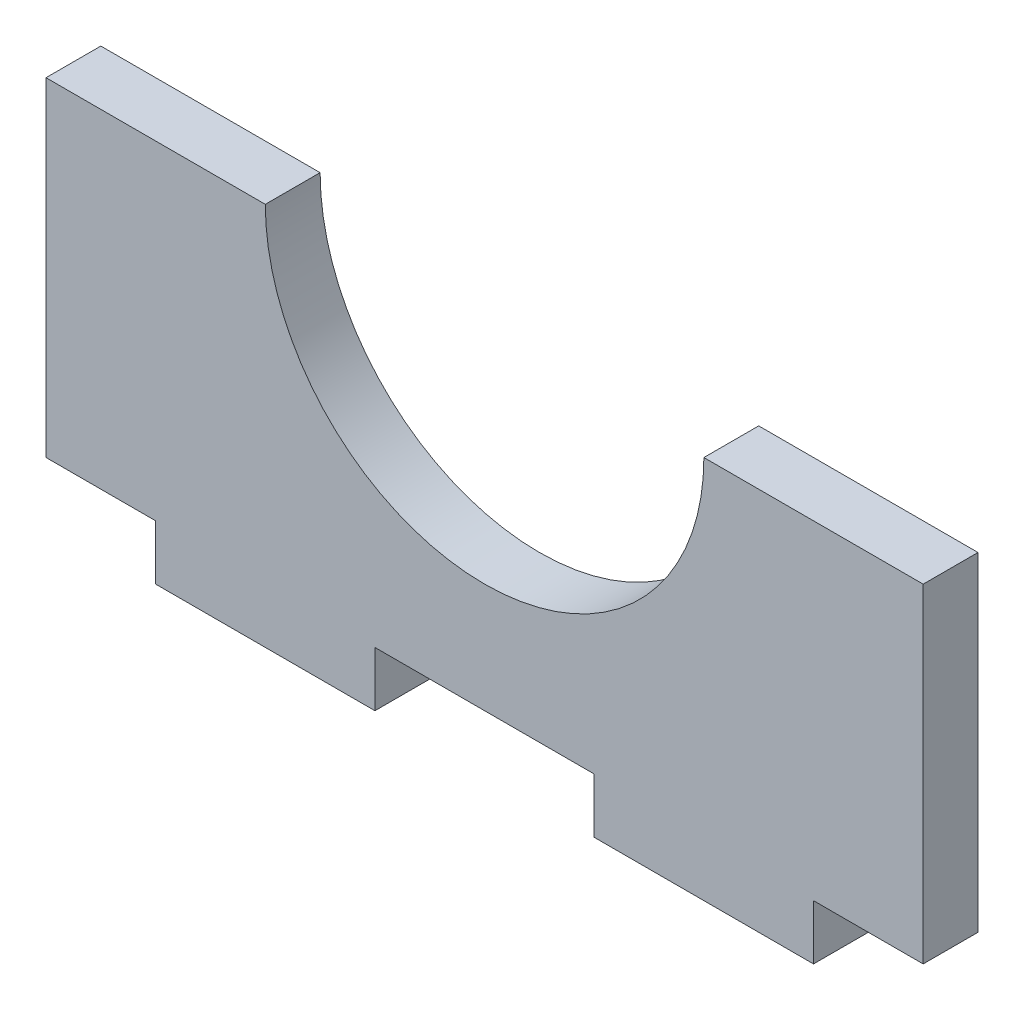
from build123d import *

# Parameters (mm, degrees)
BOSS_EXTRUDE1_DEPTH = 3.175


with BuildPart() as part:
    # Sketch1 → Boss-Extrude1 (new body)
    with BuildSketch(Plane.XY):
        with BuildLine():
            Line((-12.7, 0), (-25.4, 0))
            Line((-25.4, 0), (-25.4, -19.05))
            Line((-25.4, -19.05), (-19.05, -19.05))
            Line((-19.05, -19.05), (-19.05, -22.225))
            Line((-19.05, -22.225), (-6.35, -22.225))
            Line((-6.35, -22.225), (-6.35, -19.05))
            Line((-6.35, -19.05), (6.35, -19.05))
            Line((6.35, -19.05), (6.35, -22.225))
            Line((6.35, -22.225), (19.05, -22.225))
            Line((19.05, -22.225), (19.05, -19.05))
            Line((19.05, -19.05), (25.4, -19.05))
            Line((25.4, -19.05), (25.4, 0))
            Line((25.4, 0), (12.7, 0))
            ThreePointArc((12.7, 0), (0, -12.7), (-12.7, 0))
        make_face()
    extrude(amount=BOSS_EXTRUDE1_DEPTH)


solid = part.part
